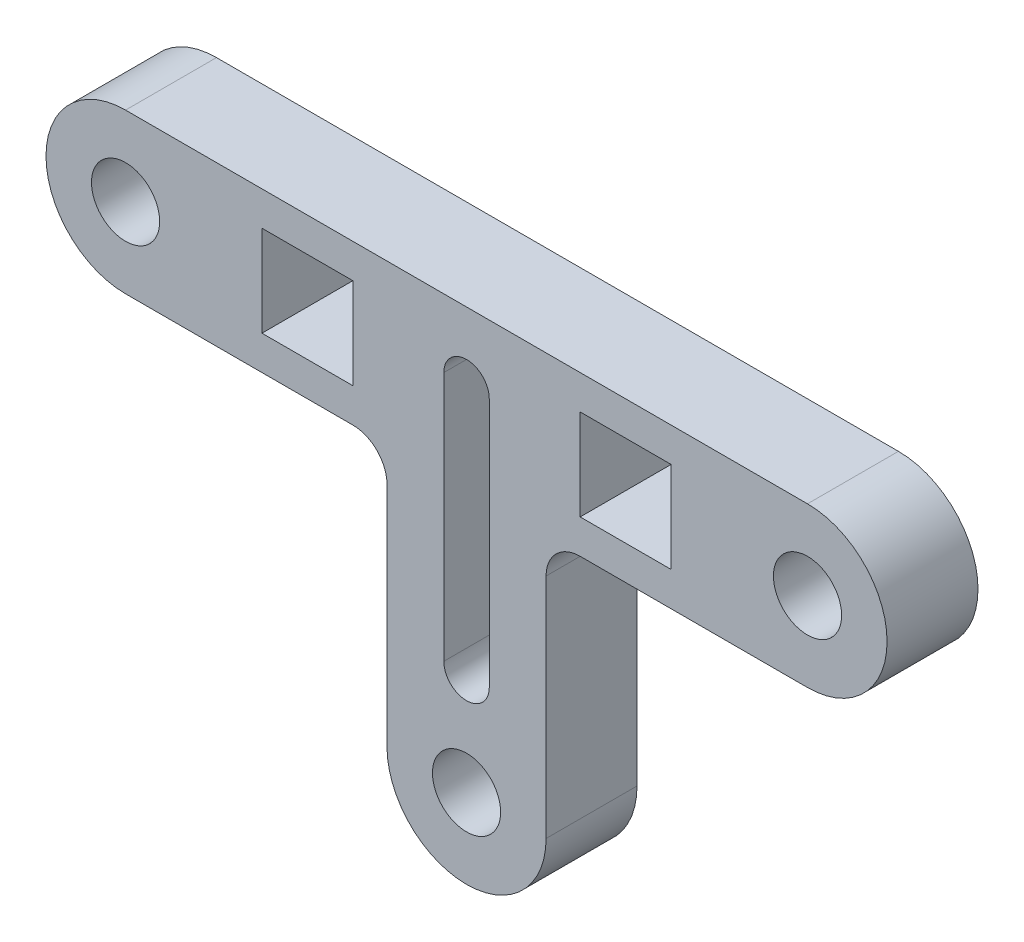
from build123d import *

# Parameters (mm, degrees)
ESQUISSE1_R             = 1.5
ESQUISSE1_W             = 4
ESQUISSE1_H             = 4
BOSS_EXTRU_1_DEPTH      = 4
ENL_V_MAT_EXTRU_1_REACH = 28.467


with BuildPart() as part:
    # Esquisse1 → Boss.-Extru.1 (new body)
    with BuildSketch(Plane.XY):
        with BuildLine():
            Line((-3.5, 0), (-3.5, 10))
            ThreePointArc((-3.5, 10), (-3.939339828, 11.060660172), (-5, 11.5))
            Line((-5, 11.5), (-15, 11.5))
            ThreePointArc((-15, 11.5), (-18.5, 15), (-15, 18.5))
            Line((-15, 18.5), (15, 18.5))
            ThreePointArc((15, 18.5), (18.5, 15), (15, 11.5))
            Line((15, 11.5), (5, 11.5))
            ThreePointArc((5, 11.5), (3.939339828, 11.060660172), (3.5, 10))
            Line((3.5, 10), (3.5, 0))
            ThreePointArc((3.5, 0), (0, -3.5), (-3.5, 0))
        make_face()
        Circle(ESQUISSE1_R, mode=Mode.SUBTRACT)
        with Locations((-15, 15)):
            Circle(ESQUISSE1_R, mode=Mode.SUBTRACT)
        with Locations((15, 15)):
            Circle(ESQUISSE1_R, mode=Mode.SUBTRACT)
        with Locations((-7, 15)):
            Rectangle(ESQUISSE1_W, ESQUISSE1_H, mode=Mode.SUBTRACT)
        with Locations((7, 15)):
            Rectangle(ESQUISSE1_W, ESQUISSE1_H, mode=Mode.SUBTRACT)
    extrude(amount=BOSS_EXTRU_1_DEPTH)

    # Esquisse2 → Enlèv. mat.-Extru.1 (cut, up to next)
    with BuildSketch(Plane.XY.offset(4), mode=Mode.PRIVATE) as enl_v_mat_extru_1_sk1:
        with BuildLine():
            Line((-1, 4.5), (-1, 15.5))
            ThreePointArc((-1, 15.5), (0, 16.5), (1, 15.5))
            Line((1, 15.5), (1, 4.5))
            ThreePointArc((1, 4.5), (0, 3.5), (-1, 4.5))
        make_face()
    enl_v_mat_extru_1_tool1 = extrude(enl_v_mat_extru_1_sk1.sketch, amount=-ENL_V_MAT_EXTRU_1_REACH, mode=Mode.PRIVATE) & part.part
    add(enl_v_mat_extru_1_tool1.solids().sort_by_distance((0, 10, 4))[0], mode=Mode.SUBTRACT)


solid = part.part
